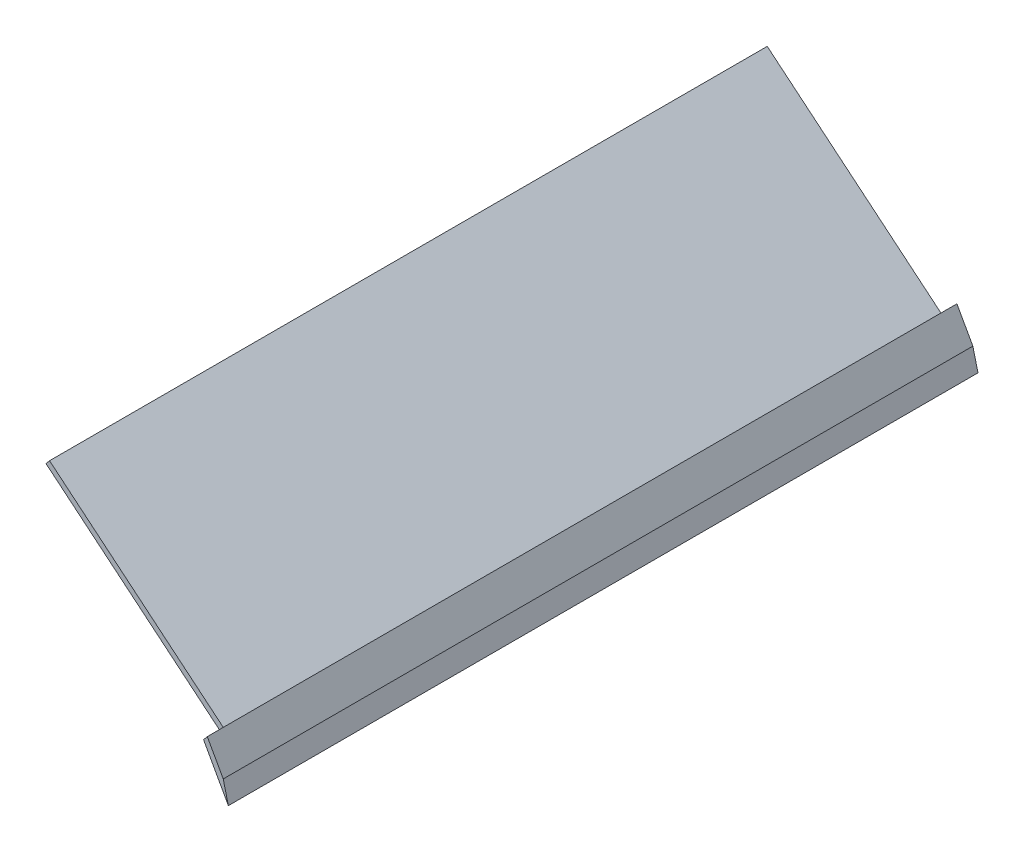
from build123d import *

# Parameters (mm, degrees)
BOSS_EXTRUDE1_DEPTH = 215.9
SKETCH2_W           = 65
SKETCH2_H           = 4.6
CUT_EXTRUDE1_DEPTH  = 229.165913841


with BuildPart() as part:
    # Sketch1 → Boss-Extrude1 (new body)
    with BuildSketch(Plane.XY):
        Polygon((187.42097357, 132.785097993), (137.579115796, 174.124053731), (138.600551034, 175.35558532), (188.63152184, 133.859778782), (193.220657018, 125.592655419), (194.701118326, 119.670240299), align=None)
    extrude(amount=-BOSS_EXTRUDE1_DEPTH)

    # Sketch2 → Cut-Extrude1 (cut, through all)
    with BuildSketch(Plane(origin=(142.652779273, 171.994657551, 0), x_dir=(0.7697072431709691, -0.6383970236538912, 0), z_dir=(0.6383970236538911, 0.769707243170969, 0))):
        with Locations((27.235364289, 2.3)):
            Rectangle(SKETCH2_W, SKETCH2_H)
        with Locations((27.235364289, 213.6)):
            Rectangle(SKETCH2_W, SKETCH2_H)
    extrude(amount=-CUT_EXTRUDE1_DEPTH, mode=Mode.SUBTRACT)


solid = part.part
